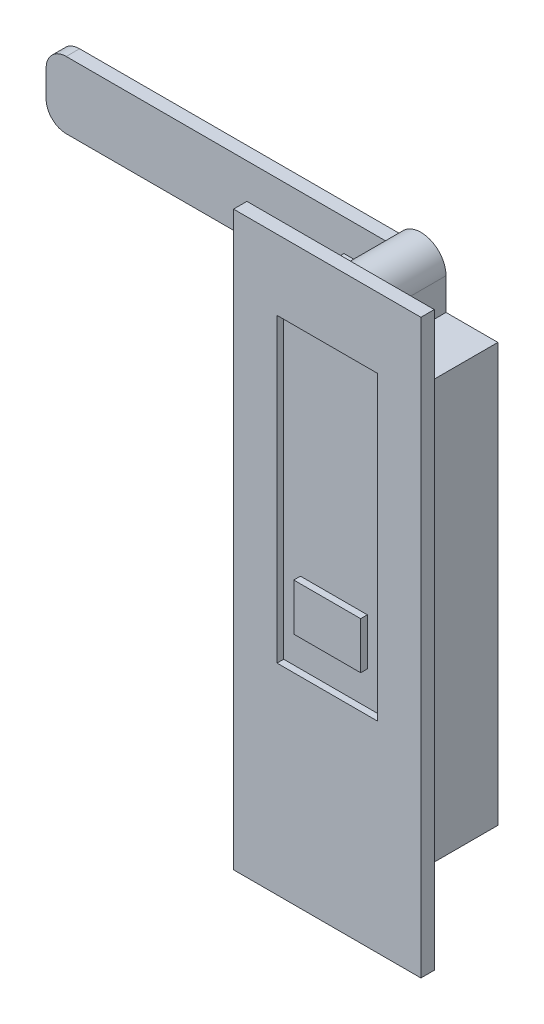
from build123d import *

# Parameters (mm, degrees)
SKETCH_1_W          = 28
SKETCH_1_H          = 85.5
EXTRUDE_1_DEPTH     = 2
SKETCH_2_W          = 15
SKETCH_2_H          = 45
SKETCH_2_W_2        = 10
SKETCH_2_H_2        = 7
CUT_EXTRUDE_1_DEPTH = 1
SKETCH_3_W          = 7.5
SKETCH_3_H          = 62.5
SKETCH_3_W_2        = 7.75
EXTRUDE_2_DEPTH     = 12
EXTRUDE_3_DEPTH     = 2


with BuildPart() as part:
    # 草图1 → 凸台-拉伸1 (new body)
    with BuildSketch(Plane.XY):
        Rectangle(SKETCH_1_W, SKETCH_1_H)
    extrude(amount=EXTRUDE_1_DEPTH)

    # 草图2 → 切除-拉伸1 (cut)
    with BuildSketch(Plane.XY.offset(2)):
        with Locations((0, 9.75)):
            Rectangle(SKETCH_2_W, SKETCH_2_H)
        with Locations((0, -4.25)):
            Rectangle(SKETCH_2_W_2, SKETCH_2_H_2, mode=Mode.SUBTRACT)
    extrude(amount=-CUT_EXTRUDE_1_DEPTH, mode=Mode.SUBTRACT)

    # 草图3 → 凸台-拉伸2 (add)
    with BuildSketch(Plane(origin=(0, 0, 0), x_dir=(-1, 0, 0), z_dir=(0, 0, -1))):
        Rectangle(SKETCH_3_W, SKETCH_3_H)
        with Locations((-7.625, 0)):
            Rectangle(SKETCH_3_W_2, SKETCH_3_H)
        with Locations((7.625, 0)):
            Rectangle(SKETCH_3_W_2, SKETCH_3_H)
        with BuildLine():
            Line((-3.75, 36), (-3.75, 31.25))
            Line((-3.75, 31.25), (3.75, 31.25))
            Line((3.75, 31.25), (3.75, 36))
            ThreePointArc((3.75, 36), (0, 39.75), (-3.75, 36))
        make_face()
        with BuildLine():
            Line((3.75, -31.25), (-3.75, -31.25))
            Line((-3.75, -31.25), (-3.75, -36))
            ThreePointArc((-3.75, -36), (0, -39.75), (3.75, -36))
            Line((3.75, -36), (3.75, -31.25))
        make_face()
    extrude(amount=EXTRUDE_2_DEPTH)

    # 草图4 → 凸台-拉伸3 (add)
    with BuildSketch(Plane(origin=(0, 0, -12), x_dir=(-1, 0, 0), z_dir=(0, 0, -1))):
        with BuildLine():
            Line((0, 36), (53, 36))
            ThreePointArc((53, 36), (55.121320344, 35.121320344), (56, 33))
            Line((56, 33), (56, 29))
            ThreePointArc((56, 29), (55.121320344, 26.878679656), (53, 26))
            Line((53, 26), (0, 26))
            Line((0, 26), (0, 36))
        make_face()
    extrude(amount=EXTRUDE_3_DEPTH)


solid = part.part
